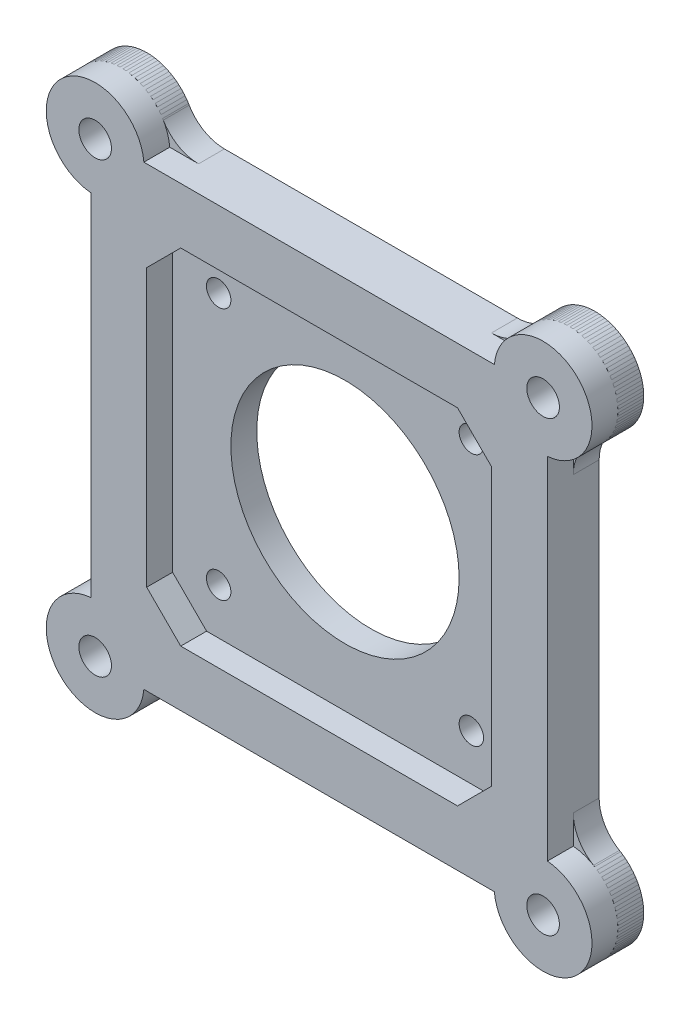
from build123d import *

# Parameters (mm, degrees)
BOSS_EXTRU_2_DEPTH        = 6.35
ESQUISSE29_R              = 6
BOSS_EXTRU_3_DEPTH        = 6.35
SYM_TRIE2_COPY_1_SKETCH_R = 6
SYM_TRIE2_COPY_1_DEPTH    = 6.35
ESQUISSE30_R              = 2
ENL_V_MAT_EXTRU_1_DEPTH   = 48.7671004
ESQUISSE31_R              = 2
BOSS_EXTRU_4_DEPTH        = 3.175
ESQUISSE32_R              = 1.5
ESQUISSE32_R_2            = 14
ENL_V_MAT_EXTRU_2_DEPTH   = 48.449488992
CONG_1_R                  = 5


with BuildPart() as part:
    # Esquisse28 → Boss.-Extru.2 (new body)
    with BuildSketch(Plane.XY):
        Polygon((-21.5, -28.005382387), (-28.005382387, -21.5), (-28.005382387, 21.5), (-21.5, 28.005382387), (21.5, 28.005382387), (28.005382387, 21.5), (28.005382387, -21.5), (21.5, -28.005382387), align=None)
        Polygon((-16.978069991, -21.15), (-21.15, -16.978069991), (-21.15, 16.978069991), (-16.978069991, 21.15), (16.978069991, 21.15), (21.15, 16.978069991), (21.15, -16.978069991), (16.978069991, -21.15), align=None, mode=Mode.SUBTRACT)
    extrude(amount=BOSS_EXTRU_2_DEPTH)

    # Esquisse29 → Boss.-Extru.3 (add)
    with BuildSketch(Plane.XY):
        with Locations((27.476658888, 27.476658888)):
            Circle(ESQUISSE29_R)
    boss_extru_3 = extrude(amount=BOSS_EXTRU_3_DEPTH)

    # Symétrie1: Boss.-Extru.3 across plane
    add(boss_extru_3.mirror(Plane(origin=(0, 0, 0), x_dir=(0, 0, 1), z_dir=(1, 0, 0))))

    # Symétrie2: Boss.-Extru.3 across plane
    add(boss_extru_3.mirror(Plane.ZX))

    # Symétrie2 copy 1 sketch → Symétrie2 copy 1 (add)
    with BuildSketch(Plane(origin=(0, 0, 0), x_dir=(-1, 0, 0), z_dir=(0, 0, 1))):
        with Locations((27.476658888, 27.476658888)):
            Circle(SYM_TRIE2_COPY_1_SKETCH_R)
    extrude(amount=SYM_TRIE2_COPY_1_DEPTH)

    # Esquisse30 → Enlèv. mat.-Extru.1 (cut, through all)
    with BuildSketch(Plane.XY.offset(6.35)):
        with Locations((-27.476658888, 27.476658888)):
            Circle(ESQUISSE30_R)
        with Locations((27.476658888, 27.476658888)):
            Circle(ESQUISSE30_R)
        with Locations((27.476658888, -27.476658888)):
            Circle(ESQUISSE30_R)
        with Locations((-27.476658888, -27.476658888)):
            Circle(ESQUISSE30_R)
    extrude(amount=-ENL_V_MAT_EXTRU_1_DEPTH, mode=Mode.SUBTRACT)


with BuildPart() as body_2:
    # Esquisse31 → Boss.-Extru.4 (new body)
    with BuildSketch(Plane.XY):
        with BuildLine():
            Line((-21.5, -28.005382387), (21.5, -28.005382387))
            ThreePointArc((21.5, -28.005382387), (31.719299575, -31.719299575), (28.005382387, -21.5))
            Line((28.005382387, -21.5), (28.005382387, 21.5))
            ThreePointArc((28.005382387, 21.5), (31.719299575, 31.719299575), (21.5, 28.005382387))
            Line((21.5, 28.005382387), (-21.5, 28.005382387))
            ThreePointArc((-21.5, 28.005382387), (-31.719299575, 31.719299575), (-28.005382387, 21.5))
            Line((-28.005382387, 21.5), (-28.005382387, -21.5))
            ThreePointArc((-28.005382387, -21.5), (-31.719299575, -31.719299575), (-21.5, -28.005382387))
        make_face()
        with Locations((27.476658888, 27.476658888)):
            Circle(ESQUISSE31_R, mode=Mode.SUBTRACT)
        with Locations((-27.476658888, 27.476658888)):
            Circle(ESQUISSE31_R, mode=Mode.SUBTRACT)
        with Locations((-27.476658888, -27.476658888)):
            Circle(ESQUISSE31_R, mode=Mode.SUBTRACT)
        with Locations((27.476658888, -27.476658888)):
            Circle(ESQUISSE31_R, mode=Mode.SUBTRACT)
    extrude(amount=BOSS_EXTRU_4_DEPTH)

    # Esquisse32 → Enlèv. mat.-Extru.2 (cut, through all)
    with BuildSketch(Plane.XY.offset(3.175)):
        with Locations((-15.5, -15.5)):
            Circle(ESQUISSE32_R)
        with Locations((15.5, -15.5)):
            Circle(ESQUISSE32_R)
        with Locations((15.5, 15.5)):
            Circle(ESQUISSE32_R)
        with Locations((-15.5, 15.5)):
            Circle(ESQUISSE32_R)
        Circle(ESQUISSE32_R_2)
    extrude(amount=-ENL_V_MAT_EXTRU_2_DEPTH, mode=Mode.SUBTRACT)

    # Congé1
    cong_1_edges = [body_2.edges().sort_by_distance(p)[0] for p in [
        (-28.005382387, -21.5, 1.5875),
        (-28.005382387, 21.5, 1.5875),
        (-21.5, 28.005382387, 1.5875),
        (21.5, 28.005382387, 1.5875),
        (28.005382387, 21.5, 1.5875),
        (28.005382387, -21.5, 1.5875),
        (21.5, -28.005382387, 1.5875),
        (-21.5, -28.005382387, 1.5875),
    ]]
    fillet(cong_1_edges, radius=CONG_1_R)


solid = Compound([part.part, body_2.part])
